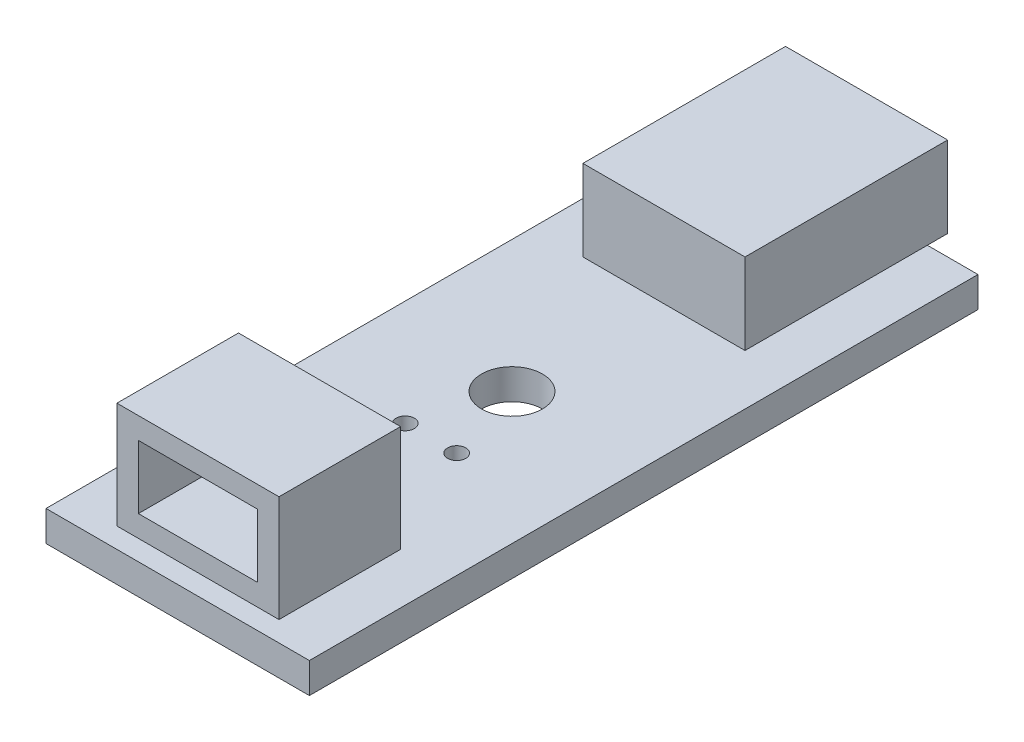
from build123d import *

# Parameters (mm, degrees)
SKETCH2_W           = 13
SKETCH2_H           = 33
BOSS_EXTRUDE1_DEPTH = 1.5
SKETCH3_W           = 8
SKETCH3_H           = 6
BOSS_EXTRUDE2_DEPTH = 5.25
SKETCH4_W           = 5.878679656
SKETCH4_H           = 3.128679656
CUT_EXTRUDE1_DEPTH  = 5
SKETCH5_R           = 1.5
CUT_EXTRUDE2_DEPTH  = 7
SKETCH6_R           = 0.45
CUT_EXTRUDE3_DEPTH  = 7
SKETCH7_W           = 8
SKETCH7_H           = 9
BOSS_EXTRUDE3_DEPTH = 4
SKETCH10_W          = 8
SKETCH10_H          = 4
BOSS_EXTRUDE5_DEPTH = 1
CUT_EXTRUDE5_DEPTH  = 5


with BuildPart() as part:
    # Sketch2 → Boss-Extrude1 (new body)
    with BuildSketch(Plane(origin=(0, 0, 0), x_dir=(1, 0, 0), z_dir=(0, 1, 0))):
        Rectangle(SKETCH2_W, SKETCH2_H)
    extrude(amount=BOSS_EXTRUDE1_DEPTH)

    # Sketch3 → Boss-Extrude2 (add)
    with BuildSketch(Plane(origin=(0, 1.5, 0), x_dir=(1, 0, 0), z_dir=(0, 1, 0))):
        with Locations((0, -12.5)):
            Rectangle(SKETCH3_W, SKETCH3_H)
    extrude(amount=BOSS_EXTRUDE2_DEPTH)

    # Sketch4 → Cut-Extrude1 (cut)
    with BuildSketch(Plane.XY.offset(15.5)):
        with Locations((0, 4.125)):
            Rectangle(SKETCH4_W, SKETCH4_H)
    extrude(amount=-CUT_EXTRUDE1_DEPTH, mode=Mode.SUBTRACT)

    # Sketch5 → Cut-Extrude2 (cut)
    with BuildSketch(Plane(origin=(0, 1.5, 0), x_dir=(1, 0, 0), z_dir=(0, 1, 0))):
        with Locations(Location((0, 0, 0), (0, 0, 270))):
            Circle(SKETCH5_R)
    extrude(amount=-CUT_EXTRUDE2_DEPTH, mode=Mode.SUBTRACT)

    # Sketch6 → Cut-Extrude3 (cut)
    with BuildSketch(Plane(origin=(0, 1.5, 0), x_dir=(1, 0, 0), z_dir=(0, 1, 0))):
        with Locations(Location((-1.27, -4, 0), (0, 0, 270))):
            Circle(SKETCH6_R)
        with Locations(Location((1.27, -4, 0), (0, 0, 270))):
            Circle(SKETCH6_R)
    extrude(amount=-CUT_EXTRUDE3_DEPTH, mode=Mode.SUBTRACT)

    # Sketch7 → Boss-Extrude3 (add)
    with BuildSketch(Plane(origin=(0, 1.5, 0), x_dir=(1, 0, 0), z_dir=(0, 1, 0))):
        with Locations((0, 12)):
            Rectangle(SKETCH7_W, SKETCH7_H)
    extrude(amount=BOSS_EXTRUDE3_DEPTH)

    # Sketch10 → Boss-Extrude5 (add)
    with BuildSketch(Plane(origin=(0, 0, -16.5), x_dir=(-1, 0, 0), z_dir=(0, 0, -1))):
        with Locations((0, 3.5)):
            Rectangle(SKETCH10_W, SKETCH10_H)
    extrude(amount=BOSS_EXTRUDE5_DEPTH)

    # Sketch12 → Cut-Extrude5 (cut)
    with BuildSketch(Plane(origin=(0, 0, -17.5), x_dir=(-1, 0, 0), z_dir=(0, 0, -1))):
        Polygon((-3.490849898, 5.00909726), (3.509150102, 5.00909726), (3.509150102, 3.75909726), (3.009150102, 3.00909726), (3.009150102, 2.00909726), (-2.990849898, 2.00909726), (-2.990849898, 3.00909726), (-3.490849898, 3.75909726), align=None)
    extrude(amount=-CUT_EXTRUDE5_DEPTH, mode=Mode.SUBTRACT)


solid = part.part
